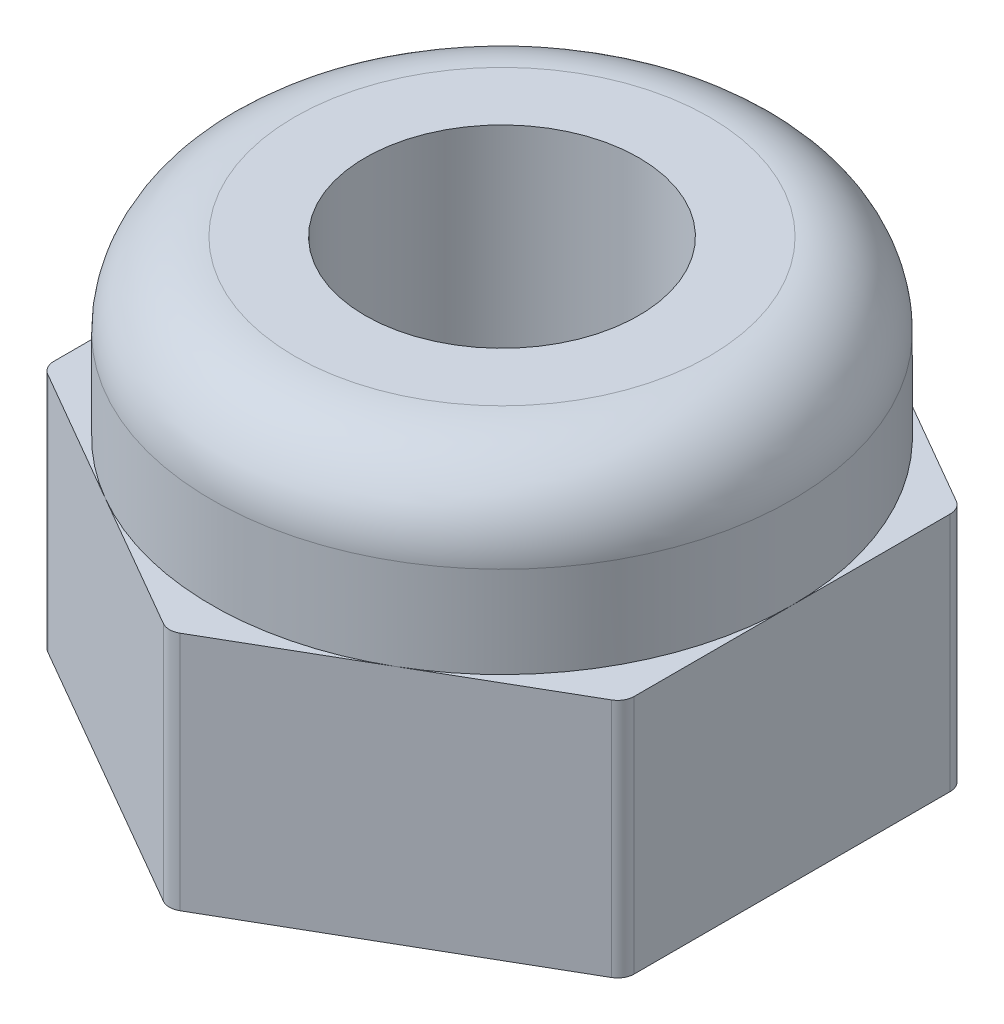
from build123d import *

# Parameters (mm, degrees)
EXTRUDE_1_DEPTH        = 2.9
SKETCH_2_R             = 3.5
EXTRUDE_2_DEPTH        = 5
FILLET_1_R             = 1
FILLET_2_R             = 0.2
HOLE_WIZARD_M4_1_D     = 3.3
HOLE_WIZARD_M4_1_DEPTH = 10.1
HOLE_WIZARD_M4_1_TIP   = 0.991420021


with BuildPart() as part:
    # 草图1 → 凸台-拉伸1 (new body)
    with BuildSketch(Plane(origin=(0, 0, 0), x_dir=(1, 0, 0), z_dir=(0, 1, 0))):
        Polygon((0, 4.041451884), (-3.5, 2.020725942), (-3.5, -2.020725942), (0, -4.041451884), (3.5, -2.020725942), (3.5, 2.020725942), align=None)
    extrude(amount=EXTRUDE_1_DEPTH)

    # 草图2 → 凸台-拉伸2 (add)
    with BuildSketch(Plane.XZ):
        with Locations(Location((0, 0, 0), (0, 0, 270))):
            Circle(SKETCH_2_R)
    extrude(amount=-EXTRUDE_2_DEPTH)

    # 圆角1
    fillet_1_edges = [part.edges().sort_by_distance(p)[0] for p in [
        (0, 5, 3.5),
    ]]
    fillet(fillet_1_edges, radius=FILLET_1_R)

    # 圆角2
    fillet_2_edges = [part.edges().sort_by_distance(p)[0] for p in [
        (3.5, 1.45, -2.020725942),
        (3.5, 1.45, 2.020725942),
        (0, 1.45, 4.041451884),
        (-3.5, 1.45, 2.020725942),
        (-3.5, 1.45, -2.020725942),
        (0, 1.45, -4.041451884),
    ]]
    fillet(fillet_2_edges, radius=FILLET_2_R)

    # M4 螺纹孔1
    with Locations(Plane(origin=(0, 0, 0), x_dir=(-1, 0, 0), z_dir=(0, -1, 0))):
        with Locations((0, 0)):
            Hole(HOLE_WIZARD_M4_1_D / 2, depth=HOLE_WIZARD_M4_1_DEPTH)
            with Locations((0, 0, -(HOLE_WIZARD_M4_1_DEPTH + HOLE_WIZARD_M4_1_TIP / 2))):  # 118° drill point
                Cone(0, HOLE_WIZARD_M4_1_D / 2, HOLE_WIZARD_M4_1_TIP, mode=Mode.SUBTRACT)


solid = part.part
